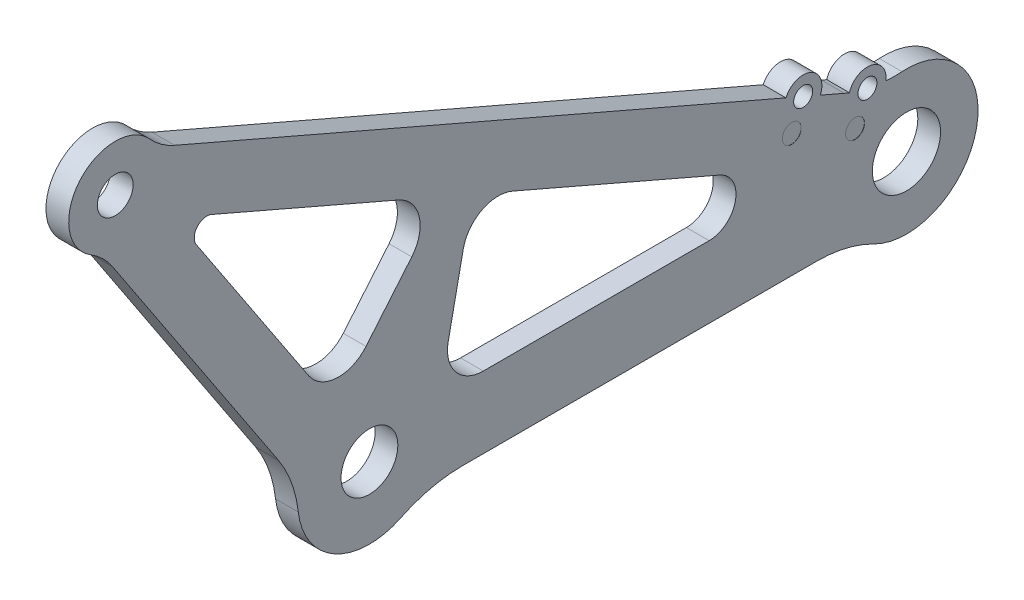
from build123d import *

# Parameters (mm, degrees)
BOSS_EXTRUDE1_DEPTH         = 6.35
F_3_4_0_75_DIAMETER_HOLE1_D = 19.05
F_10_0_10_DIAMETER_HOLE1_D  = 10
F_5_8_DIAMETER_HOLE2_D      = 15.875
CUT_EXTRUDE1_REACH          = 205.594
FILLET1_R                   = 35
FILLET3_R                   = 35
FILLET4_R                   = 20
FILLET6_R                   = 40
SKETCH22_R                  = 2.65
CUT_EXTRUDE2_DEPTH          = 10
SKETCH24_R                  = 2.65
CUT_EXTRUDE3_DEPTH          = 10
BOSS_EXTRUDE4_DEPTH         = 6.35
BOSS_EXTRUDE5_DEPTH         = 6.35
SKETCH30_R                  = 2.65
CUT_EXTRUDE4_DEPTH          = 6.35
SKETCH31_R                  = 2.131200652
CUT_EXTRUDE5_DEPTH          = 6.35
SKETCH32_R                  = 2.65
CUT_EXTRUDE6_DEPTH          = 6.35
SKETCH33_R                  = 2.65
SKETCH33_R_2                = 3.724628158
BOSS_EXTRUDE6_DEPTH         = 6.3
CUT_EXTRUDE7_START          = -10
SKETCH34_R                  = 2.65
CUT_EXTRUDE7_DEPTH          = 10
BOSS_EXTRUDE7_START         = -6.3
SKETCH35_R                  = 2.65
BOSS_EXTRUDE7_DEPTH         = 6.3


with BuildPart() as part:
    # Sketch1 → Boss-Extrude1 (new body)
    with BuildSketch(Plane(origin=(0, 0, 0), x_dir=(0, 0, -1), z_dir=(1, 0, 0))):
        with BuildLine():
            Line((-60.717143143, 0), (60.717143143, 0))
            ThreePointArc((60.717143143, 0), (94.584407895, 9.944020783), (67.452353804, 32.521151068))
            Line((67.452353804, 32.521151068), (-134.404938559, 119.878311848))
            ThreePointArc((-134.404938559, 119.878311848), (-155.966181949, 122.347168224), (-149.752887031, 101.553480851))
            Line((-149.752887031, 101.553480851), (-94.55805454, 18.181208272))
            ThreePointArc((-94.55805454, 18.181208272), (-84.465516954, -3.618285637), (-60.717143143, 0))
        make_face()
    extrude(amount=BOSS_EXTRUDE1_DEPTH)

    # 3/4 (0.75) Diameter Hole1 (through all)
    with Locations(Plane(origin=(6.35, 0, 0), x_dir=(0, 0, -1), z_dir=(1, 0, 0))):
        with Locations((75, 14)):
            Hole(F_3_4_0_75_DIAMETER_HOLE1_D / 2)

    # Ø10.0 (10) Diameter Hole1 (through all)
    with Locations(Plane(origin=(6.35, 0, 0), x_dir=(0, 0, -1), z_dir=(1, 0, 0))):
        with Locations((-146, 114)):
            Hole(F_10_0_10_DIAMETER_HOLE1_D / 2)

    # Ø5/8" Diameter Hole2 (through all)
    with Locations(Plane(origin=(6.35, 0, 0), x_dir=(0, 0, -1), z_dir=(1, 0, 0))):
        with Locations((-75, 14)):
            Hole(F_5_8_DIAMETER_HOLE2_D / 2)

    # Sketch8 → Cut-Extrude1 (cut, up to next)
    with BuildSketch(Plane(origin=(6.35, 0, 0), x_dir=(0, 0, -1), z_dir=(1, 0, 0)), mode=Mode.PRIVATE) as cut_extrude1_sk1:
        with BuildLine():
            Line((-52.98768213, 32.027989609), (-48.791838571, 52.287736349))
            ThreePointArc((-48.791838571, 52.287736349), (-43.609219792, 59.133963583), (-35.027937054, 59.43719837))
            Line((-35.027937054, 59.43719837), (22.864909862, 34.383088722))
            ThreePointArc((22.864909862, 34.383088722), (27.230289645, 25.979007794), (19.886136685, 20))
            Line((19.886136685, 20), (-43.195478183, 20))
            ThreePointArc((-43.195478183, 20), (-50.950473221, 23.686518238), (-52.98768213, 32.027989609))
        make_face()
    cut_extrude1_tool1 = extrude(cut_extrude1_sk1.sketch, amount=-CUT_EXTRUDE1_REACH, mode=Mode.PRIVATE) & part.part
    # Sketch8 → Cut-Extrude1 (cut, up to next)
    with BuildSketch(Plane(origin=(6.35, 0, 0), x_dir=(0, 0, -1), z_dir=(1, 0, 0)), mode=Mode.PRIVATE) as cut_extrude1_sk2:
        with BuildLine():
            Line((-75.95726339, 42.34340423), (-63.166421785, 57.61515284))
            ThreePointArc((-63.166421785, 57.61515284), (-61.101947711, 66.340863059), (-66.861018022, 73.213503103))
            Line((-66.861018022, 73.213503103), (-119.037006728, 95.793545572))
            ThreePointArc((-119.037006728, 95.793545572), (-123.11030371, 94.828752024), (-123.345509052, 90.649367698))
            Line((-123.345509052, 90.649367698), (-91.961866267, 43.244103424))
            ThreePointArc((-91.961866267, 43.244103424), (-84.185443207, 38.780101137), (-75.95726339, 42.34340423))
        make_face()
    cut_extrude1_tool2 = extrude(cut_extrude1_sk2.sketch, amount=-CUT_EXTRUDE1_REACH, mode=Mode.PRIVATE) & part.part
    add(cut_extrude1_tool1.solids().sort_by_distance((6.35, 35.497015, 18.727672))[0], mode=Mode.SUBTRACT)
    add(cut_extrude1_tool2.solids().sort_by_distance((6.35, 67.079595, 89.97893))[0], mode=Mode.SUBTRACT)

    # Fillet1
    fillet1_edges = [part.edges().sort_by_distance(p)[0] for p in [
        (3.175, 18.181208272, 94.55805454),
    ]]
    fillet(fillet1_edges, radius=FILLET1_R)

    # Fillet3
    fillet3_edges = [part.edges().sort_by_distance(p)[0] for p in [
        (3.175, 32.521151068, -67.452353804),
        (3.175, 0, -60.717143143),
    ]]
    fillet(fillet3_edges, radius=FILLET3_R)

    # Fillet4
    fillet4_edges = [part.edges().sort_by_distance(p)[0] for p in [
        (3.175, 101.553480851, 149.752887031),
        (3.175, 119.878311848, 134.404938559),
    ]]
    fillet(fillet4_edges, radius=FILLET4_R)

    # Fillet6
    fillet6_edges = [part.edges().sort_by_distance(p)[0] for p in [
        (3.175, 0, 60.717143143),
    ]]
    fillet(fillet6_edges, radius=FILLET6_R)

    # Sketch22 → Cut-Extrude2 (cut)
    with BuildSketch(Plane(origin=(6.35, 0, 0), x_dir=(0, 0, -1), z_dir=(1, 0, 0))):
        with Locations((60.644779113, 26.750227475)):
            Circle(SKETCH22_R)
    extrude(amount=-CUT_EXTRUDE2_DEPTH, mode=Mode.SUBTRACT)

    # Sketch24 → Cut-Extrude3 (cut)
    with BuildSketch(Plane(origin=(6.35, 0, 0), x_dir=(0, 0, -1), z_dir=(1, 0, 0))):
        with Locations((42.966527297, 34.400790246)):
            Circle(SKETCH24_R)
    extrude(amount=-CUT_EXTRUDE3_DEPTH, mode=Mode.SUBTRACT)

    # Sketch25 → Boss-Extrude4 (add)
    with BuildSketch(Plane(origin=(6.35, 0, 0), x_dir=(0, 0, -1), z_dir=(1, 0, 0))):
        with BuildLine():
            ThreePointArc((43.711860671, 42.795251406), (46.681302599, 44.337685596), (48.793885353, 41.74275155))
            ThreePointArc((48.793885353, 41.74275155), (48.738819399, 41.205334304), (48.575910035, 40.690251694))
            Line((48.575910035, 40.690251694), (50.945207618, 39.664898052))
            ThreePointArc((50.945207618, 39.664898052), (48.221738851, 46.544073815), (41.342563089, 43.820605048))
            Line((41.342563089, 43.820605048), (43.711860671, 42.795251406))
        make_face()
    extrude(amount=-BOSS_EXTRUDE4_DEPTH)

    # Sketch29 → Boss-Extrude5 (add)
    with BuildSketch(Plane(origin=(6.35, 0, 0), x_dir=(0, 0, -1), z_dir=(1, 0, 0))):
        with BuildLine():
            ThreePointArc((69.263055818, 33.964695583), (65.196576348, 39.805321361), (59.068365536, 36.186730888))
            ThreePointArc((59.068365536, 36.186730888), (60.5303447, 35.66620465), (62.013960909, 35.210997462))
            ThreePointArc((62.013960909, 35.210997462), (64.343055459, 36.809883075), (66.21463271, 34.693680056))
            ThreePointArc((66.21463271, 34.693680056), (66.205602012, 34.497647468), (66.178586414, 34.303275437))
            ThreePointArc((66.178586414, 34.303275437), (67.717067085, 34.099786208), (69.263055818, 33.964695583))
        make_face()
    extrude(amount=-BOSS_EXTRUDE5_DEPTH)

    # Sketch30 → Cut-Extrude4 (cut)
    with BuildSketch(Plane(origin=(6.35, 0, 0), x_dir=(0, 0, -1), z_dir=(1, 0, 0))):
        with Locations((46.143885353, 41.74275155)):
            Circle(SKETCH30_R)
    extrude(amount=-CUT_EXTRUDE4_DEPTH, mode=Mode.SUBTRACT)

    # Sketch31 → Cut-Extrude5 (cut)
    with BuildSketch(Plane(origin=(6.35, 0, 0), x_dir=(0, 0, -1), z_dir=(1, 0, 0))):
        with Locations((64.096273662, 34.757136449)):
            Circle(SKETCH31_R)
    extrude(amount=-CUT_EXTRUDE5_DEPTH, mode=Mode.SUBTRACT)

    # Sketch32 → Cut-Extrude6 (cut)
    with BuildSketch(Plane(origin=(6.35, 0, 0), x_dir=(0, 0, -1), z_dir=(1, 0, 0))):
        with Locations((64.096273662, 34.757136449)):
            Circle(SKETCH32_R)
    extrude(amount=-CUT_EXTRUDE6_DEPTH, mode=Mode.SUBTRACT)

    # Sketch33 → Boss-Extrude6 (add)
    with BuildSketch(Plane(origin=(6.35, 0, 0), x_dir=(0, 0, -1), z_dir=(1, 0, 0))):
        with Locations((42.966527297, 34.400790246)):
            Circle(SKETCH33_R)
        with Locations((60.715336282, 26.683263033)):
            Circle(SKETCH33_R_2)
    extrude(amount=-BOSS_EXTRUDE6_DEPTH)

    # Sketch34 → Cut-Extrude7 (cut)
    with BuildSketch(Plane.ZY.offset(CUT_EXTRUDE7_START)):
        with Locations(Location((-60.644779113, 26.750227475, 0), (0, 0, 180))):
            Circle(SKETCH34_R)
        with Locations(Location((-42.966527297, 34.400790246, 0), (0, 0, 180))):
            Circle(SKETCH34_R)
    extrude(amount=CUT_EXTRUDE7_DEPTH, mode=Mode.SUBTRACT)

    # Sketch35 → Boss-Extrude7 (add)
    with BuildSketch(Plane.ZY.offset(BOSS_EXTRUDE7_START)):
        with Locations(Location((-60.644779113, 26.750227475, 0), (0, 0, 180))):
            Circle(SKETCH35_R)
        with Locations(Location((-42.966527297, 34.400790246, 0), (0, 0, 180))):
            Circle(SKETCH35_R)
    extrude(amount=BOSS_EXTRUDE7_DEPTH)


solid = part.part
